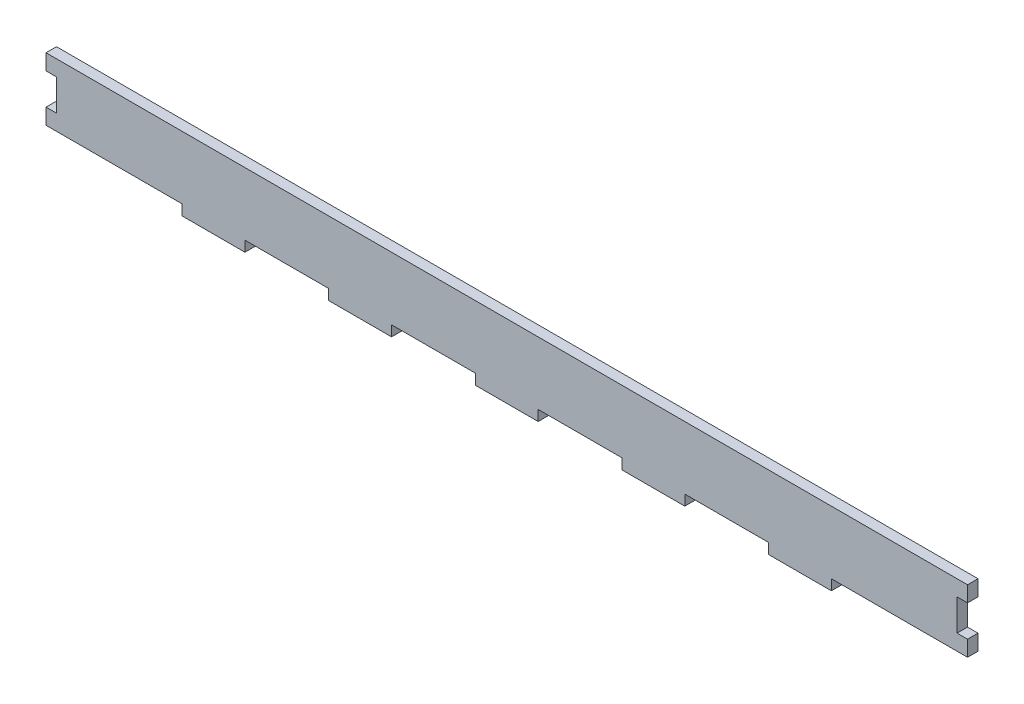
from build123d import *

# Parameters (mm, degrees)
BOSS_EXTRUDE1_DEPTH = 5


with BuildPart() as part:
    # Sketch1 → Boss-Extrude1 (new body)
    with BuildSketch(Plane.XY):
        Polygon((170, -430), (210, -430), (210, -435), (240, -435), (240, -430), (280, -430), (280, -435), (310, -435), (310, -430), (350, -430), (350, -435), (380, -435), (380, -430), (440.000271395, -430), (445, -430), (445, -422.5), (440.000271395, -422.5), (440.000271395, -407.5), (445, -407.5), (445, -400), (440.000271395, -400), (9.999728605, -400), (5, -400), (5, -407.5), (9.999728605, -407.5), (9.999728605, -422.5), (5, -422.5), (5, -430), (9.999728605, -430), (70, -430), (70, -435), (100, -435), (100, -430), (140, -430), (140, -435), (170, -435), align=None)
    extrude(amount=-BOSS_EXTRUDE1_DEPTH)


solid = part.part
